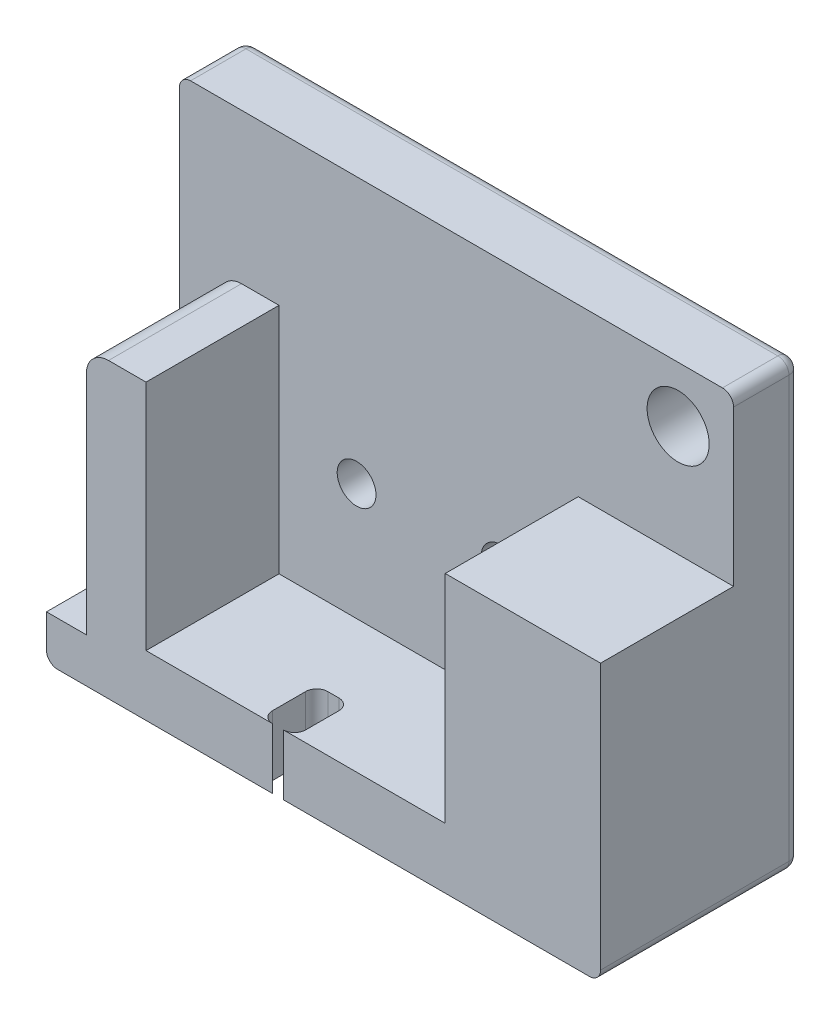
from build123d import *

# Parameters (mm, degrees)
ESQUISSE1_W             = 25
ESQUISSE1_H             = 20
ESQUISSE1_R             = 1.4
ESQUISSE1_R_2           = 0.875
BOSS_EXTRU_1_DEPTH      = 3
BOSS_EXTRU_2_DEPTH      = 6
ENL_V_MAT_EXTRU_1_DEPTH = 6
ESQUISSE4_R             = 2
ENL_V_MAT_EXTRU_2_DEPTH = 1
CONG_1_R                = 0.5
ESQUISSE5_R             = 1.4
ENL_V_MAT_EXTRU_3_DEPTH = 6


with BuildPart() as part:
    # Esquisse1 → Boss.-Extru.1 (new body)
    with BuildSketch(Plane.XY):
        with Locations((12.5, 10)):
            Rectangle(ESQUISSE1_W, ESQUISSE1_H)
        with Locations((22.5, 17.5)):
            Circle(ESQUISSE1_R, mode=Mode.SUBTRACT)
        with Locations((14.491447915, 8)):
            Circle(ESQUISSE1_R_2, mode=Mode.SUBTRACT)
        with Locations((7.991447915, 8)):
            Circle(ESQUISSE1_R_2, mode=Mode.SUBTRACT)
    extrude(amount=BOSS_EXTRU_1_DEPTH)

    # Esquisse2 → Boss.-Extru.2 (add)
    with BuildSketch(Plane.XY.offset(3)):
        with BuildLine():
            Line((0, 2), (1.8, 2))
            Line((1.8, 2), (1.8, 12.222275421))
            ThreePointArc((1.8, 12.222275421), (2.092893219, 12.929382202), (2.8, 13.222275421))
            Line((2.8, 13.222275421), (4.491447915, 13.222275421))
            Line((4.491447915, 13.222275421), (4.491447915, 2.730724668))
            Line((4.491447915, 2.730724668), (17.991447915, 2.730724668))
            Line((17.991447915, 2.730724668), (17.991447915, 12.493838982))
            Line((17.991447915, 12.493838982), (25, 12.493838982))
            Line((25, 12.493838982), (25, 0))
            Line((25, 0), (0, 0))
            Line((0, 0), (0, 2))
        make_face()
    extrude(amount=BOSS_EXTRU_2_DEPTH)

    # Esquisse3 → Enlèv. mat.-Extru.1 (cut)
    with BuildSketch(Plane(origin=(0, 2.730724668, 0), x_dir=(1, 0, 0), z_dir=(0, 1, 0))):
        with BuildLine():
            Line((9.692490841, -8.5), (9.692490841, -7))
            ThreePointArc((9.692490841, -7), (9.838937451, -6.646446609), (10.192490841, -6.5))
            Line((10.192490841, -6.5), (10.692490841, -6.5))
            ThreePointArc((10.692490841, -6.5), (11.046044232, -6.646446609), (11.192490841, -7))
            Line((11.192490841, -7), (11.192490841, -8.5))
            ThreePointArc((11.192490841, -8.5), (11.046044232, -8.853553391), (10.692490841, -9))
            Line((10.692490841, -9), (10.192490841, -9))
            ThreePointArc((10.192490841, -9), (9.838937451, -8.853553391), (9.692490841, -8.5))
        make_face()
    extrude(amount=-ENL_V_MAT_EXTRU_1_DEPTH, mode=Mode.SUBTRACT)

    # Esquisse4 → Enlèv. mat.-Extru.2 (cut)
    with BuildSketch(Plane.ZY.offset(-1.8)):
        with Locations((6, 8)):
            Circle(ESQUISSE4_R)
    extrude(amount=-ENL_V_MAT_EXTRU_2_DEPTH, mode=Mode.SUBTRACT)

    # Congé1
    cong_1_edges = [part.edges().sort_by_distance(p)[0] for p in [
        (12.5, 20, 0),
        (25, 10, 0),
        (12.5, 0, 0),
        (0, 10, 0),
        (0, 20, 1.5),
        (25, 20, 1.5),
        (25, 0, 4.5),
        (0, 0, 4.5),
    ]]
    fillet(cong_1_edges, radius=CONG_1_R)

    # Esquisse5 → Enlèv. mat.-Extru.3 (cut)
    with BuildSketch(Plane.XZ):
        with Locations(Location((21.12309895, 5.598466424, 0), (0, 0, 270))):
            Circle(ESQUISSE5_R)
    extrude(amount=-ENL_V_MAT_EXTRU_3_DEPTH, mode=Mode.SUBTRACT)


solid = part.part
